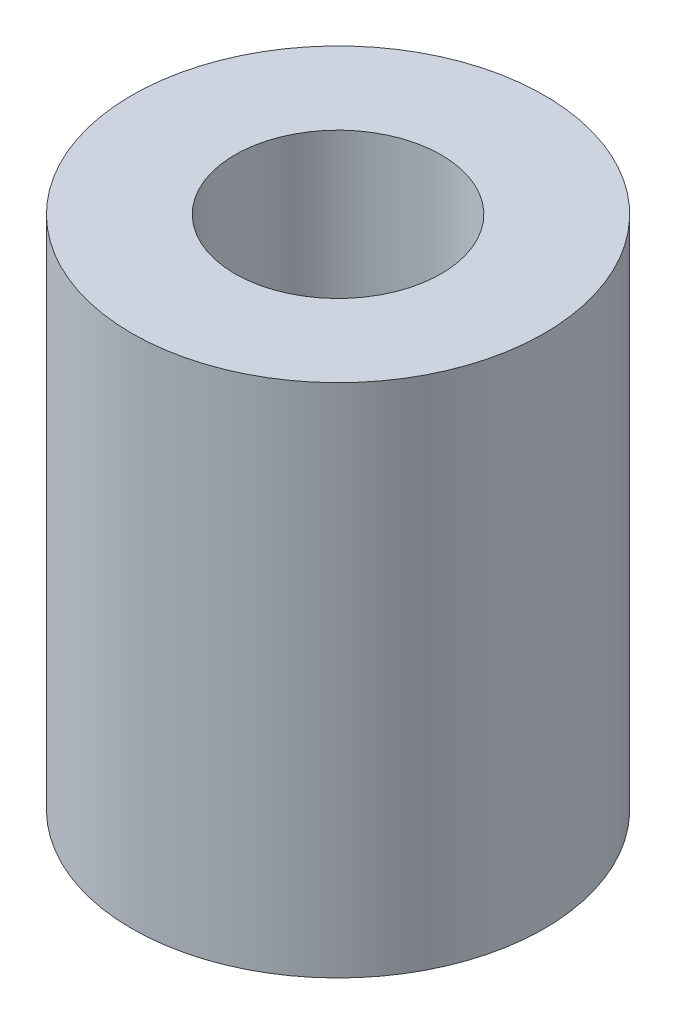
from build123d import *

# Parameters (mm, degrees)
SKETCH1_R           = 10
SKETCH1_R_2         = 5
BOSS_EXTRUDE1_DEPTH = 25


with BuildPart() as part:
    # Sketch1 → Boss-Extrude1 (new body)
    with BuildSketch(Plane(origin=(0, 0, 0), x_dir=(1, 0, 0), z_dir=(0, 1, 0))):
        with Locations(Location((0, 0, 0), (0, 0, 270))):
            Circle(SKETCH1_R)
        with Locations(Location((0, 0, 0), (0, 0, 270))):
            Circle(SKETCH1_R_2, mode=Mode.SUBTRACT)
    extrude(amount=BOSS_EXTRUDE1_DEPTH)


solid = part.part
